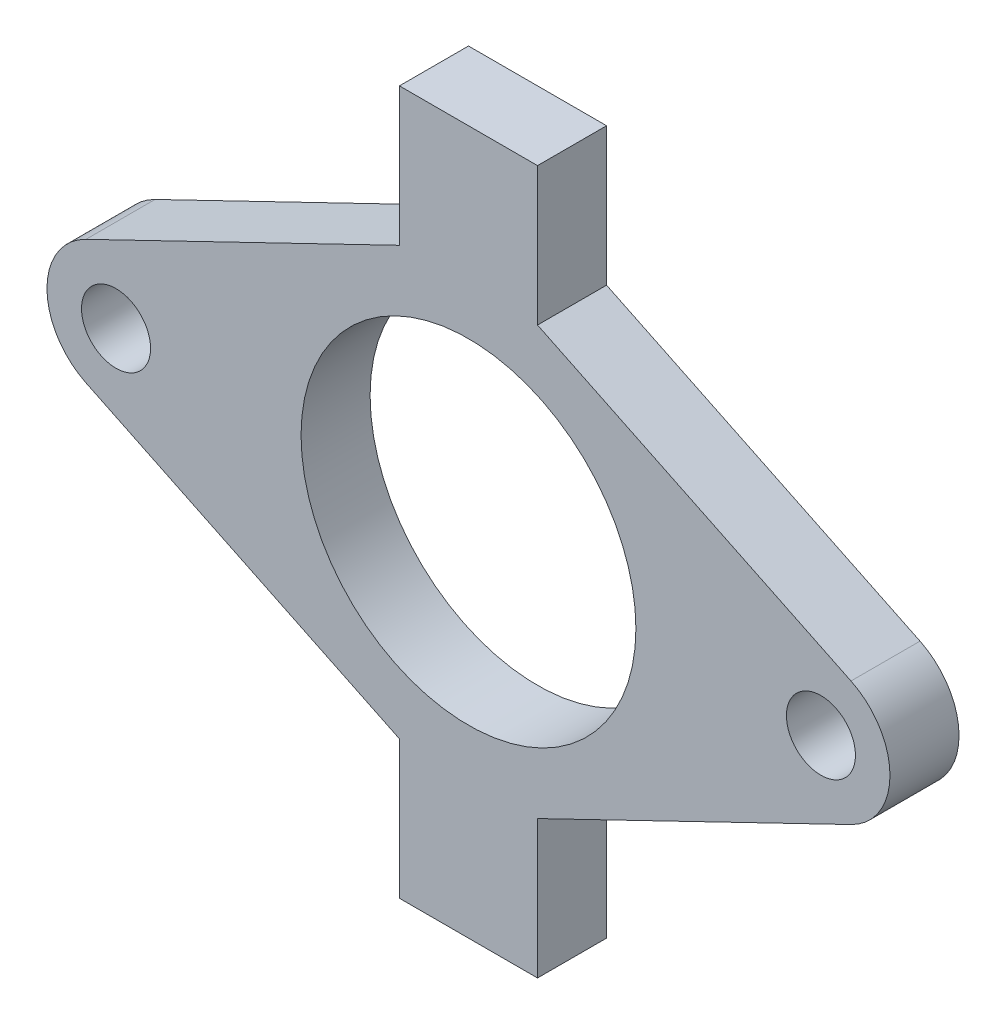
from build123d import *

# Parameters (mm, degrees)
SKETCH1_R           = 24.25
SKETCH1_R_2         = 5
BOSS_EXTRUDE1_DEPTH = 10


with BuildPart() as part:
    # Sketch1 → Boss-Extrude1 (new body)
    with BuildSketch(Plane.XY):
        with BuildLine():
            Line((10, 54.25), (-10, 54.25))
            Line((-10, 54.25), (-10, 34.25))
            Line((-10, 34.25), (-55.400247003, 12.302884399))
            ThreePointArc((-55.400247003, 12.302884399), (-61.047971586, 3.299679487), (-55.400247003, -5.703525425))
            Line((-55.400247003, -5.703525425), (-10, -27.650641026))
            Line((-10, -27.650641026), (-10, -47.650641026))
            Line((-10, -47.650641026), (10, -47.650641026))
            Line((10, -47.650641026), (10, -27.650641026))
            Line((10, -27.650641026), (55.400247003, -5.703525425))
            ThreePointArc((55.400247003, -5.703525425), (61.047971586, 3.299679487), (55.400247003, 12.302884399))
            Line((55.400247003, 12.302884399), (10, 34.25))
            Line((10, 34.25), (10, 54.25))
        make_face()
        with Locations((0, 3.299679487)):
            Circle(SKETCH1_R, mode=Mode.SUBTRACT)
        with Locations((51.047971586, 3.299679487)):
            Circle(SKETCH1_R_2, mode=Mode.SUBTRACT)
        with Locations((-51.047971586, 3.299679487)):
            Circle(SKETCH1_R_2, mode=Mode.SUBTRACT)
    extrude(amount=-BOSS_EXTRUDE1_DEPTH)


solid = part.part
